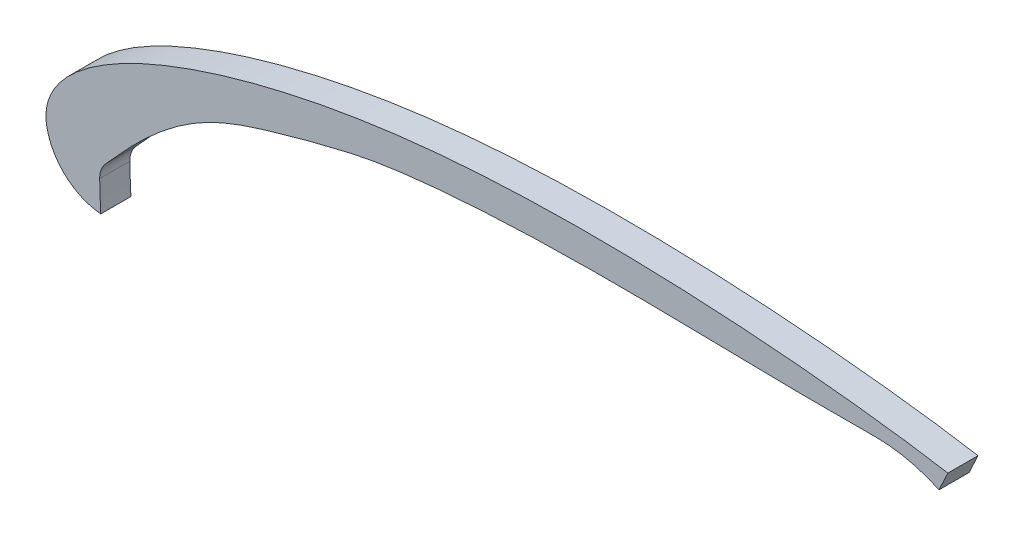
from build123d import *

# Parameters (mm, degrees)
P_IDAT_VYSUNUT_M1_DEPTH = 1


with BuildPart() as part:
    # Skica1 → Přidat vysunutím1 (new, symmetric)
    with BuildSketch(Plane.XY):
        with BuildLine():
            Line((0, 10), (-5, 10))
            add(Edge.make_bspline(
                [(-5, 10), (-8.333333333, 10), (-20.483124003, 10.480551078), (-31.545644915, 9.63491203), (-34.795612613, 8.894087439)],
                knots=[0, 0, 0, 0, 0.534031624, 1, 1, 1, 1], degree=3))
            add(Edge.make_bspline(
                [(-34.795612613, 8.894087439), (-35.098801198, 8.824976118), (-35.401847399, 8.754105152), (-36.527647002, 8.484205361), (-37.350041762, 8.273925014), (-38.585610164, 7.938774284), (-38.997795956, 7.823769118), (-39.823263845, 7.587149684), (-40.236463849, 7.46628865), (-41.492153235, 7.08226066), (-42.342193993, 6.798788339), (-43.587301665, 6.278073912), (-44.000007617, 6.086017609), (-44.788441649, 5.673269167), (-45.165712934, 5.453616504), (-46.968620216, 4.310881513), (-48.145197593, 3.255811413), (-49.537601283, 1.852981398), (-49.939692058, 1.414729225), (-50.445106342, 0.855114539), (-50.597252853, 0.684916497), (-50.864765777, 0.3891951), (-50.980598253, 0.263389457), (-51.071394458, 0.169367234)],
                knots=[0.476985196, 0.476985196, 0.476985196, 0.476985196, 0.5, 0.5, 0.5625, 0.5625, 0.59375, 0.59375, 0.625, 0.625, 0.6875, 0.6875, 0.71875, 0.71875, 0.75, 0.75, 0.875, 0.875, 0.9375, 0.9375, 0.96875, 0.96875, 1, 1, 1, 1], degree=3))
            ThreePointArc((-51.071394458, 0.169367234), (-51.38801111, -0.322868482), (-51.492156301, -0.898798932))
            ThreePointArc((-51.492156301, -0.898798932), (-51.464988764, -1.898665721), (-51.4184078, -2.897816303))
            ThreePointArc((-51.4184078, -2.897816303), (-53.748630988, -1.886538688), (-55, 0.324049043))
            add(Edge.make_bspline(
                [(4.812792818, 10.321067504), (-0.439515198, 11.247191119), (-32.097973841, 15.080973729), (-55.954044977, 5.23218496), (-55, 0.324049043)],
                knots=[0, 0, 0, 0, 0.525665788, 0.985260281, 0.985260281, 0.985260281, 0.985260281], degree=3))
            Line((4.812792818, 10.321067504), (4.226182617, 9.06307787))
            ThreePointArc((4.226182617, 9.06307787), (2.164396139, 9.762960071), (0, 10))
        make_face()
    extrude(amount=P_IDAT_VYSUNUT_M1_DEPTH, both=True)


solid = part.part
